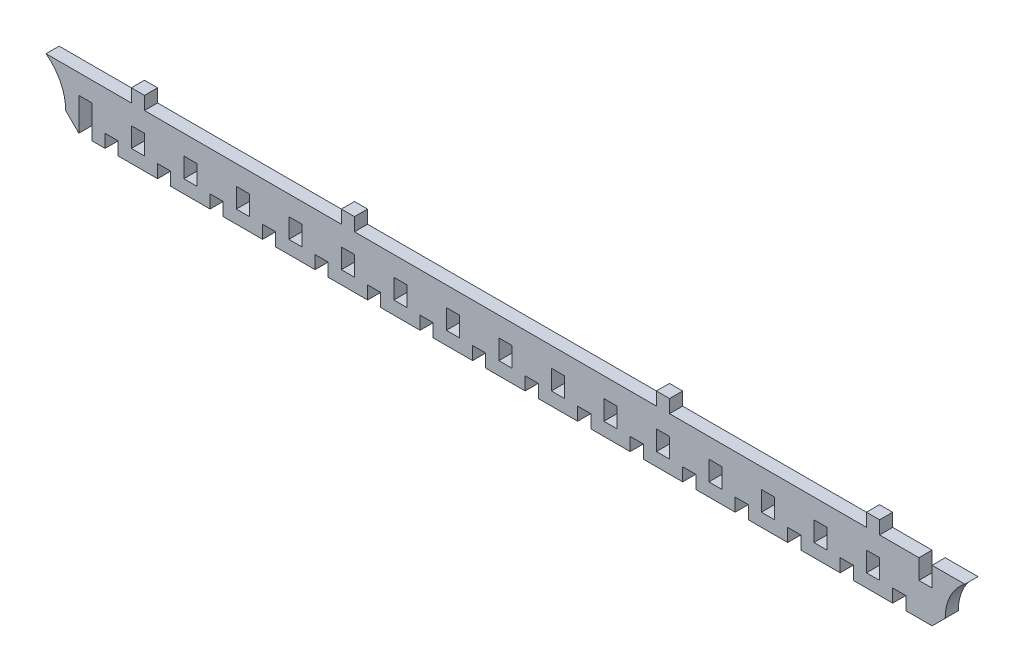
from build123d import *

# Parameters (mm, degrees)
SKETCH1_W           = 3
SKETCH1_H           = 4.5
BOSS_EXTRUDE1_DEPTH = 3


with BuildPart() as part:
    # Sketch1 → Boss-Extrude1 (new body)
    with BuildSketch(Plane.XY):
        with BuildLine():
            Line((187.5, 3), (187.5, 6))
            Line((187.5, 6), (184.5, 6))
            Line((184.5, 6), (184.5, 3))
            Line((184.5, 3), (175.5, 3))
            Line((175.5, 3), (175.5, 6))
            Line((175.5, 6), (172.5, 6))
            Line((172.5, 6), (172.5, 3))
            Line((172.5, 3), (163.5, 3))
            Line((163.5, 3), (163.5, 6))
            Line((163.5, 6), (160.5, 6))
            Line((160.5, 6), (160.5, 3))
            Line((160.5, 3), (151.5, 3))
            Line((151.5, 3), (151.5, 6))
            Line((151.5, 6), (148.5, 6))
            Line((148.5, 6), (148.5, 3))
            Line((148.5, 3), (139.5, 3))
            Line((139.5, 3), (139.5, 6))
            Line((139.5, 6), (136.5, 6))
            Line((136.5, 6), (136.5, 3))
            Line((136.5, 3), (127.5, 3))
            Line((127.5, 3), (127.5, 6))
            Line((127.5, 6), (124.5, 6))
            Line((124.5, 6), (124.5, 3))
            Line((124.5, 3), (115.5, 3))
            Line((115.5, 3), (115.5, 6))
            Line((115.5, 6), (112.5, 6))
            Line((112.5, 6), (112.5, 3))
            Line((112.5, 3), (103.5, 3))
            Line((103.5, 3), (103.5, 6))
            Line((103.5, 6), (100.5, 6))
            Line((100.5, 6), (100.5, 3))
            Line((100.5, 3), (91.5, 3))
            Line((91.5, 3), (91.5, 6))
            Line((91.5, 6), (88.5, 6))
            Line((88.5, 6), (88.5, 3))
            Line((88.5, 3), (79.5, 3))
            Line((79.5, 3), (79.5, 6))
            Line((79.5, 6), (76.5, 6))
            Line((76.5, 6), (76.5, 3))
            Line((76.5, 3), (67.5, 3))
            Line((67.5, 3), (67.5, 6))
            Line((67.5, 6), (64.5, 6))
            Line((64.5, 6), (64.5, 3))
            Line((64.5, 3), (55.5, 3))
            Line((55.5, 3), (55.5, 6))
            Line((55.5, 6), (52.5, 6))
            Line((52.5, 6), (52.5, 3))
            Line((52.5, 3), (43.5, 3))
            Line((43.5, 3), (43.5, 6))
            Line((43.5, 6), (40.5, 6))
            Line((40.5, 6), (40.5, 3))
            Line((40.5, 3), (31.5, 3))
            Line((31.5, 3), (31.5, 6))
            Line((31.5, 6), (28.5, 6))
            Line((28.5, 6), (28.5, 3))
            Line((28.5, 3), (19.5, 3))
            Line((19.5, 3), (19.5, 6))
            Line((19.5, 6), (16.5, 6))
            Line((16.5, 6), (16.5, 3))
            Line((16.5, 3), (13.5, 3))
            Line((13.5, 3), (13.5, 10.5))
            Line((13.5, 10.5), (10.5, 10.5))
            Line((10.5, 10.5), (10.5, 3))
            Line((10.5, 3), (7.5, 6))
            ThreePointArc((7.5, 6), (6.312305899, 11.031152949), (3, 15))
            Line((3, 15), (22.5, 15))
            Line((22.5, 15), (22.5, 18))
            Line((22.5, 18), (25.5, 18))
            Line((25.5, 18), (25.5, 15))
            Line((25.5, 15), (70.5, 15))
            Line((70.5, 15), (70.5, 18))
            Line((70.5, 18), (73.5, 18))
            Line((73.5, 18), (73.5, 15))
            Line((73.5, 15), (142.5, 15))
            Line((142.5, 15), (142.5, 18))
            Line((142.5, 18), (145.5, 18))
            Line((145.5, 18), (145.5, 15))
            Line((145.5, 15), (190.5, 15))
            Line((190.5, 15), (190.5, 18))
            Line((190.5, 18), (193.5, 18))
            Line((193.5, 18), (193.5, 15))
            Line((193.5, 15), (202.5, 15))
            Line((202.5, 15), (202.5, 10.5))
            Line((202.5, 10.5), (205.5, 10.5))
            Line((205.5, 10.5), (205.5, 15))
            Line((205.5, 15), (213, 15))
            ThreePointArc((213, 15), (209.687694101, 11.031152949), (208.5, 6))
            Line((208.5, 6), (205.5, 3))
            Line((205.5, 3), (199.5, 3))
            Line((199.5, 3), (199.5, 6))
            Line((199.5, 6), (196.5, 6))
            Line((196.5, 6), (196.5, 3))
            Line((196.5, 3), (187.5, 3))
        make_face()
        with Locations((24, 8.25)):
            Rectangle(SKETCH1_W, SKETCH1_H, mode=Mode.SUBTRACT)
        with Locations((36, 8.25)):
            Rectangle(SKETCH1_W, SKETCH1_H, mode=Mode.SUBTRACT)
        with Locations((48, 8.25)):
            Rectangle(SKETCH1_W, SKETCH1_H, mode=Mode.SUBTRACT)
        with Locations((60, 8.25)):
            Rectangle(SKETCH1_W, SKETCH1_H, mode=Mode.SUBTRACT)
        with Locations((72, 8.25)):
            Rectangle(SKETCH1_W, SKETCH1_H, mode=Mode.SUBTRACT)
        with Locations((84, 8.25)):
            Rectangle(SKETCH1_W, SKETCH1_H, mode=Mode.SUBTRACT)
        with Locations((96, 8.25)):
            Rectangle(SKETCH1_W, SKETCH1_H, mode=Mode.SUBTRACT)
        with Locations((108, 8.25)):
            Rectangle(SKETCH1_W, SKETCH1_H, mode=Mode.SUBTRACT)
        with Locations((120, 8.25)):
            Rectangle(SKETCH1_W, SKETCH1_H, mode=Mode.SUBTRACT)
        with Locations((132, 8.25)):
            Rectangle(SKETCH1_W, SKETCH1_H, mode=Mode.SUBTRACT)
        with Locations((144, 8.25)):
            Rectangle(SKETCH1_W, SKETCH1_H, mode=Mode.SUBTRACT)
        with Locations((156, 8.25)):
            Rectangle(SKETCH1_W, SKETCH1_H, mode=Mode.SUBTRACT)
        with Locations((168, 8.25)):
            Rectangle(SKETCH1_W, SKETCH1_H, mode=Mode.SUBTRACT)
        with Locations((180, 8.25)):
            Rectangle(SKETCH1_W, SKETCH1_H, mode=Mode.SUBTRACT)
        with Locations((192, 8.25)):
            Rectangle(SKETCH1_W, SKETCH1_H, mode=Mode.SUBTRACT)
    extrude(amount=BOSS_EXTRUDE1_DEPTH)


solid = part.part
